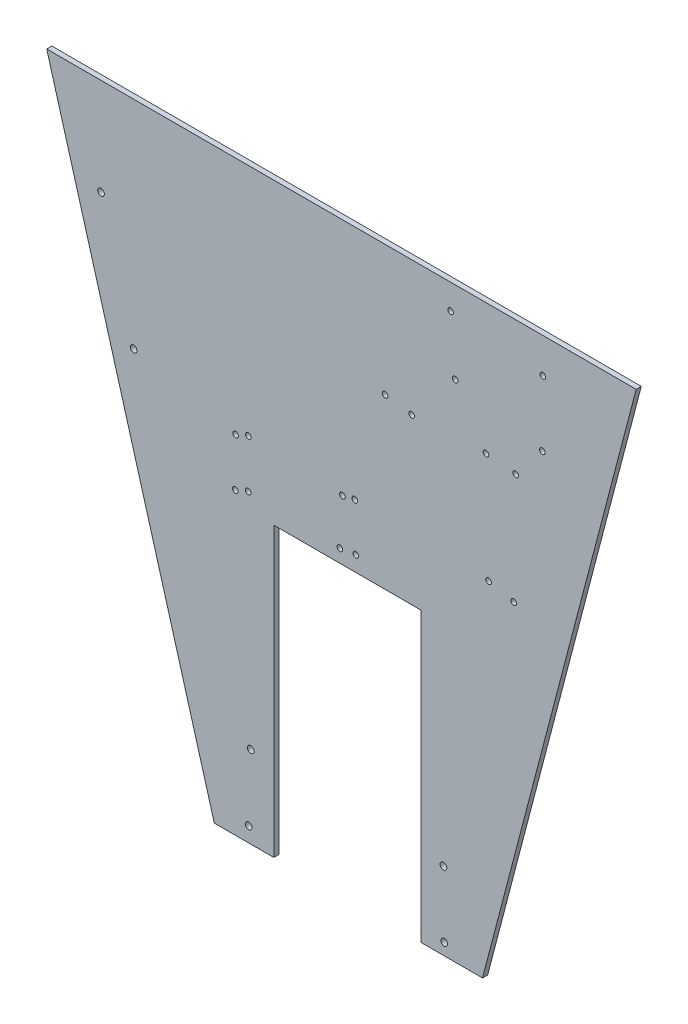
from build123d import *

# Parameters (mm, degrees)
SKETCH1_R           = 2.75
BOSS_EXTRUDE1_DEPTH = 5
SKETCH2_R           = 3.25
BOSS_EXTRUDE2_DEPTH = 5
SKETCH3_R           = 2.75
BOSS_EXTRUDE3_DEPTH = 5
SKETCH4_R           = 3.25
BOSS_EXTRUDE4_DEPTH = 5
SKETCH5_R           = 2.75
BOSS_EXTRUDE5_DEPTH = 5
SKETCH6_R           = 3.25
BOSS_EXTRUDE6_DEPTH = 5


with BuildPart() as part:
    # Sketch1 → Boss-Extrude1 (new body)
    with BuildSketch(Plane.XY):
        Polygon((0, 210), (0, 0), (230, 0), (285, 210), align=None)
        with Locations((104, 185.5)):
            Circle(SKETCH1_R, mode=Mode.SUBTRACT)
        with Locations((194, 176)):
            Circle(SKETCH1_R, mode=Mode.SUBTRACT)
        with Locations((108.5, 130)):
            Circle(SKETCH1_R, mode=Mode.SUBTRACT)
        with Locations((193.5, 112)):
            Circle(SKETCH1_R, mode=Mode.SUBTRACT)
        with Locations((138.5, 82.5)):
            Circle(SKETCH1_R, mode=Mode.SUBTRACT)
        with Locations((167.5, 79.5)):
            Circle(SKETCH1_R, mode=Mode.SUBTRACT)
        with Locations((40, 83)):
            Circle(SKETCH1_R, mode=Mode.SUBTRACT)
        with Locations((66, 79)):
            Circle(SKETCH1_R, mode=Mode.SUBTRACT)
    extrude(amount=BOSS_EXTRUDE1_DEPTH)

    # Sketch2 → Boss-Extrude2 (add)
    with BuildSketch(Plane.XY):
        with BuildLine():
            Line((-202.121956495, 0), (0, 0))
            Line((0, 0), (0, 210))
            Line((0, 210), (-290, 210))
            Line((-290, 210), (-230, 0))
            Line((-230, 0), (-208.306614933, 0))
            ThreePointArc((-208.306614933, 0), (-205.214285714, 2.25), (-202.121956495, 0))
        make_face()
        with Locations((-237, 115.5)):
            Circle(SKETCH2_R, mode=Mode.SUBTRACT)
    extrude(amount=BOSS_EXTRUDE2_DEPTH)

    # Sketch3 → Boss-Extrude3 (add)
    with BuildSketch(Plane.XY):
        with BuildLine():
            Line((-208.306614933, 0), (-230, 0))
            Line((-230, 0), (-170, -210))
            Line((-170, -210), (-68.5, -210))
            Line((-68.5, -210), (-68.5, -81.5))
            Line((-68.5, -81.5), (0, -81.5))
            Line((0, -81.5), (0, -25.304886114))
            ThreePointArc((0, -25.304886114), (-4.25, -23), (0, -20.695113886))
            Line((0, -20.695113886), (0, 0))
            Line((0, 0), (-202.121956495, 0))
            ThreePointArc((-202.121956495, 0), (-202.003945393, -0.493823135), (-201.964285714, -1))
            ThreePointArc((-201.964285714, -1), (-205.720462579, -4.210340322), (-208.306614933, 0))
        make_face()
        with Locations((-106, -70.5)):
            Circle(SKETCH3_R, mode=Mode.SUBTRACT)
        with Locations((-93.5, -65.5)):
            Circle(SKETCH3_R, mode=Mode.SUBTRACT)
        with Locations((-4, -68.75)):
            Circle(SKETCH3_R, mode=Mode.SUBTRACT)
        with Locations((-105.75, -23.5)):
            Circle(SKETCH3_R, mode=Mode.SUBTRACT)
        with Locations((-93.25, -18.5)):
            Circle(SKETCH3_R, mode=Mode.SUBTRACT)
    extrude(amount=BOSS_EXTRUDE3_DEPTH)

    # Sketch4 → Boss-Extrude4 (add)
    with BuildSketch(Plane.XY):
        Polygon((-170, -210), (-126.5, -362.25), (-68.5, -362.25), (-68.5, -210), align=None)
        with Locations((-93, -347.75)):
            Circle(SKETCH4_R, mode=Mode.SUBTRACT)
        with Locations((-91, -282.25)):
            Circle(SKETCH4_R, mode=Mode.SUBTRACT)
    extrude(amount=BOSS_EXTRUDE4_DEPTH)

    # Sketch5 → Boss-Extrude5 (add)
    with BuildSketch(Plane.XY):
        with BuildLine():
            Line((0, -25.304886114), (0, -81.5))
            Line((0, -81.5), (75, -81.5))
            Line((75, -81.5), (75, -210))
            Line((75, -210), (175, -210))
            Line((175, -210), (230, 0))
            Line((230, 0), (0, 0))
            Line((0, 0), (0, -20.695113886))
            ThreePointArc((0, -20.695113886), (0.917384951, -21.68898894), (1.25, -23))
            ThreePointArc((1.25, -23), (0.917384951, -24.31101106), (0, -25.304886114))
        make_face()
        with Locations((11.5, -66.5)):
            Circle(SKETCH5_R, mode=Mode.SUBTRACT)
        with Locations((10.5, -20.5)):
            Circle(SKETCH5_R, mode=Mode.SUBTRACT)
        with Locations((165.5, -29.5)):
            Circle(SKETCH5_R, mode=Mode.SUBTRACT)
        with Locations((141, -24)):
            Circle(SKETCH5_R, mode=Mode.SUBTRACT)
    extrude(amount=BOSS_EXTRUDE5_DEPTH)

    # Sketch6 → Boss-Extrude6 (add)
    with BuildSketch(Plane.XY):
        Polygon((75, -210), (75, -362.25), (135.125, -362.25), (175, -210), align=None)
        with Locations((97.75, -350.75)):
            Circle(SKETCH6_R, mode=Mode.SUBTRACT)
        with Locations((97, -286.75)):
            Circle(SKETCH6_R, mode=Mode.SUBTRACT)
    extrude(amount=BOSS_EXTRUDE6_DEPTH)


solid = part.part
